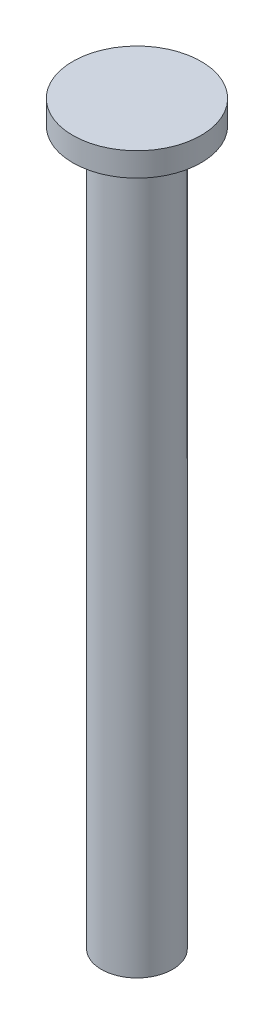
from build123d import *

# Parameters (mm, degrees)
IZIM2_R                     = 2.7
Y_KSEKLIK_EKSTR_ZYON1_DEPTH = 1
IZIM3_R                     = 1.5
Y_KSEKLIK_EKSTR_ZYON2_DEPTH = 30


with BuildPart() as part:
    # Çizim2 → Yükseklik-Ekstrüzyon1 (new body)
    with BuildSketch(Plane(origin=(0, 0, 0), x_dir=(1, 0, 0), z_dir=(0, 1, 0))):
        with Locations(Location((0, 0, 0), (0, 0, 270))):
            Circle(IZIM2_R)
    extrude(amount=Y_KSEKLIK_EKSTR_ZYON1_DEPTH)

    # Çizim3 → Yükseklik-Ekstrüzyon2 (add)
    with BuildSketch(Plane.XZ):
        with Locations(Location((0, 0, 0), (0, 0, 270))):
            Circle(IZIM3_R)
    extrude(amount=Y_KSEKLIK_EKSTR_ZYON2_DEPTH)


solid = part.part
